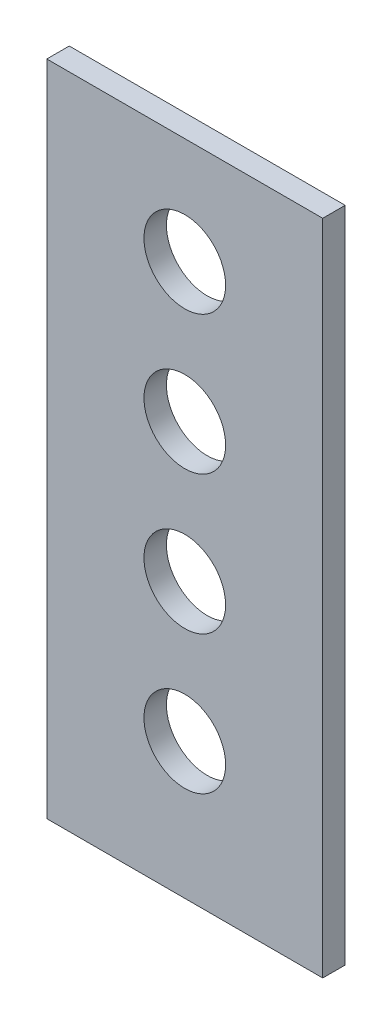
from build123d import *

# Parameters (mm, degrees)
SKETCH_1_W      = 67.586214045
SKETCH_1_H      = 161.164904789
SKETCH_1_R      = 10
EXTRUDE_1_DEPTH = 5.5


with BuildPart() as part:
    # Эскиз1 → Вытянуть1 (new body)
    with BuildSketch(Plane.XY):
        with Locations((33.793107023, -80.582452395)):
            Rectangle(SKETCH_1_W, SKETCH_1_H)
        with Locations((33.793107022, -26.108970618)):
            Circle(SKETCH_1_R, mode=Mode.SUBTRACT)
        with Locations((33.793107022, -60.020624256)):
            Circle(SKETCH_1_R, mode=Mode.SUBTRACT)
        with Locations((33.793107022, -93.932277895)):
            Circle(SKETCH_1_R, mode=Mode.SUBTRACT)
        with Locations((33.793107022, -127.843931533)):
            Circle(SKETCH_1_R, mode=Mode.SUBTRACT)
    extrude(amount=EXTRUDE_1_DEPTH)


solid = part.part
